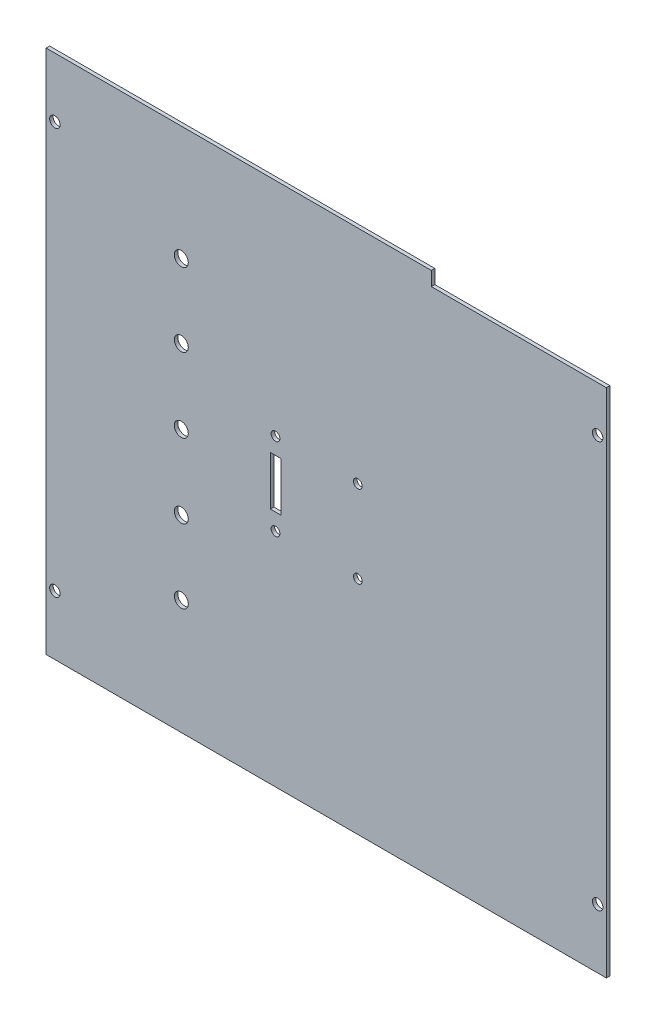
from build123d import *

# Parameters (mm, degrees)
SKETCH1_W           = 160
SKETCH1_H           = 150
BOSS_EXTRUDE1_DEPTH = 1
SKETCH3_R           = 1.5
SKETCH3_R_2         = 1.25
SKETCH3_R_3         = 2
SKETCH3_W           = 50
SKETCH3_H           = 4
SKETCH3_W_2         = 3
SKETCH3_H_2         = 14
CUT_EXTRUDE1_DEPTH  = 10


with BuildPart() as part:
    # Sketch1 → Boss-Extrude1 (new body)
    with BuildSketch(Plane.XY):
        Rectangle(SKETCH1_W, SKETCH1_H)
    extrude(amount=BOSS_EXTRUDE1_DEPTH)

    # Sketch3 → Cut-Extrude1 (cut)
    with BuildSketch(Plane.XY.offset(1)):
        with Locations((-77.5, -58)):
            Circle(SKETCH3_R)
        with Locations((77.5, -58)):
            Circle(SKETCH3_R)
        with Locations((77.5, 58)):
            Circle(SKETCH3_R)
        with Locations((-77.5, 58)):
            Circle(SKETCH3_R)
        with Locations((-14.483915959, -11.75)):
            Circle(SKETCH3_R_2)
        with Locations((9.016084041, -11.75)):
            Circle(SKETCH3_R_2)
        with Locations((9.016084041, 11.75)):
            Circle(SKETCH3_R_2)
        with Locations((-14.483915959, 11.75)):
            Circle(SKETCH3_R_2)
        with Locations((-41.40147673, 0)):
            Circle(SKETCH3_R_3)
        with Locations((-41.40147673, -21.215676989)):
            Circle(SKETCH3_R_3)
        with Locations((-41.40147673, 21.215676989)):
            Circle(SKETCH3_R_3)
        with Locations((-41.40147673, -42.218866747)):
            Circle(SKETCH3_R_3)
        with Locations((-41.40147673, 42.218866747)):
            Circle(SKETCH3_R_3)
        with Locations((55, 73)):
            Rectangle(SKETCH3_W, SKETCH3_H)
        with Locations((-14.483915959, 0)):
            Rectangle(SKETCH3_W_2, SKETCH3_H_2)
    extrude(amount=-CUT_EXTRUDE1_DEPTH, mode=Mode.SUBTRACT)


solid = part.part
